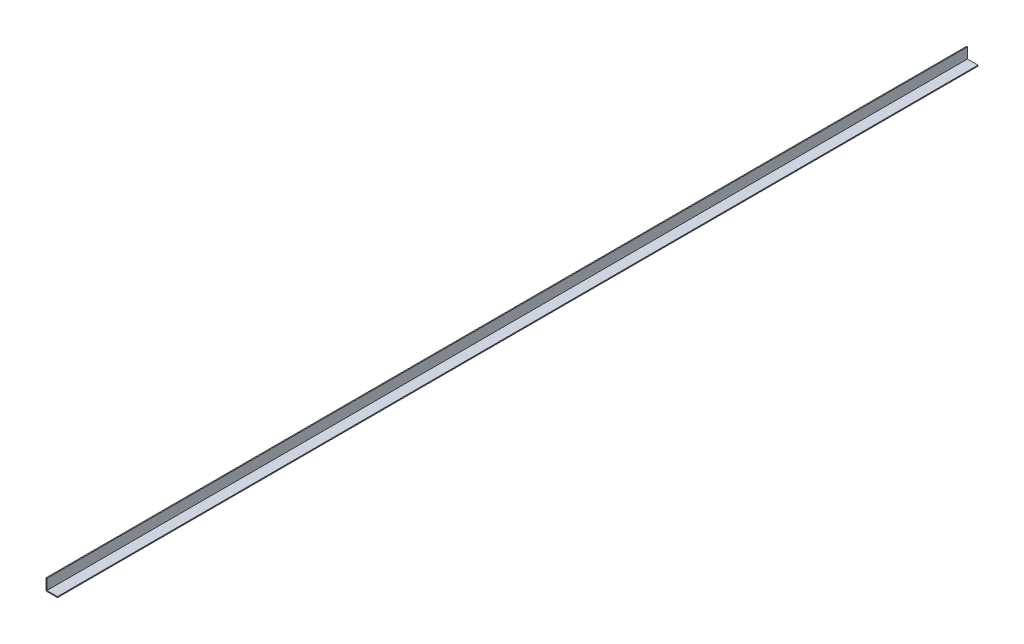
from build123d import *

# Parameters (mm, degrees)
SALIENTE_EXTRUIR1_DEPTH = 6100


with BuildPart() as part:
    # Croquis1 → Saliente-Extruir1 (new body)
    with BuildSketch(Plane.XY):
        Polygon((0, 76.2), (0, 0), (76.2, 0), (76.2, 6.35), (6.35, 6.35), (6.35, 76.2), align=None)
    extrude(amount=-SALIENTE_EXTRUIR1_DEPTH)


solid = part.part
